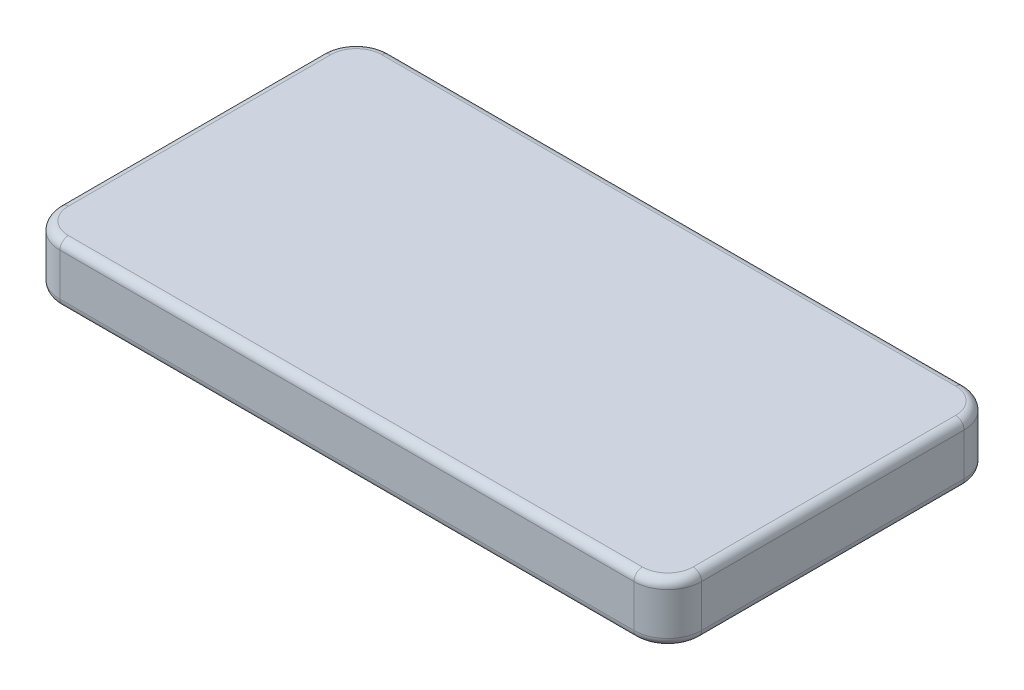
from build123d import *

# Parameters (mm, degrees)
SKETCH1_W           = 96.266
SKETCH1_H           = 49.53
BOSS_EXTRUDE1_DEPTH = 4.445
FILLET1_R           = 5.08
FILLET2_R           = 1.27


with BuildPart() as part:
    # Sketch1 → Boss-Extrude1 (new, symmetric)
    with BuildSketch(Plane(origin=(0, 0, 0), x_dir=(1, 0, 0), z_dir=(0, 1, 0))):
        Rectangle(SKETCH1_W, SKETCH1_H)
    extrude(amount=BOSS_EXTRUDE1_DEPTH, both=True)

    # Fillet1
    fillet1_edges = [part.edges().sort_by_distance(p)[0] for p in [
        (48.133, 0, 24.765),
        (-48.133, 0, 24.765),
        (-48.133, 0, -24.765),
        (48.133, 0, -24.765),
    ]]
    fillet(fillet1_edges, radius=FILLET1_R)

    # Fillet2
    fillet2_edges = [part.edges().sort_by_distance(p)[0] for p in [
        (-48.133, -4.445, 0),
        (-48.133, 4.445, 0),
        (48.133, -4.445, 0),
        (0, -4.445, 24.765),
        (0, -4.445, -24.765),
        (46.645102448, -4.445, 23.277102448),
        (46.645102448, -4.445, -23.277102448),
        (-46.645102448, -4.445, 23.277102448),
        (-46.645102448, -4.445, -23.277102448),
        (0, 4.445, -24.765),
        (48.133, 4.445, 0),
        (0, 4.445, 24.765),
        (46.645102448, 4.445, 23.277102448),
        (46.645102448, 4.445, -23.277102448),
        (-46.645102448, 4.445, 23.277102448),
        (-46.645102448, 4.445, -23.277102448),
    ]]
    fillet(fillet2_edges, radius=FILLET2_R)


solid = part.part
